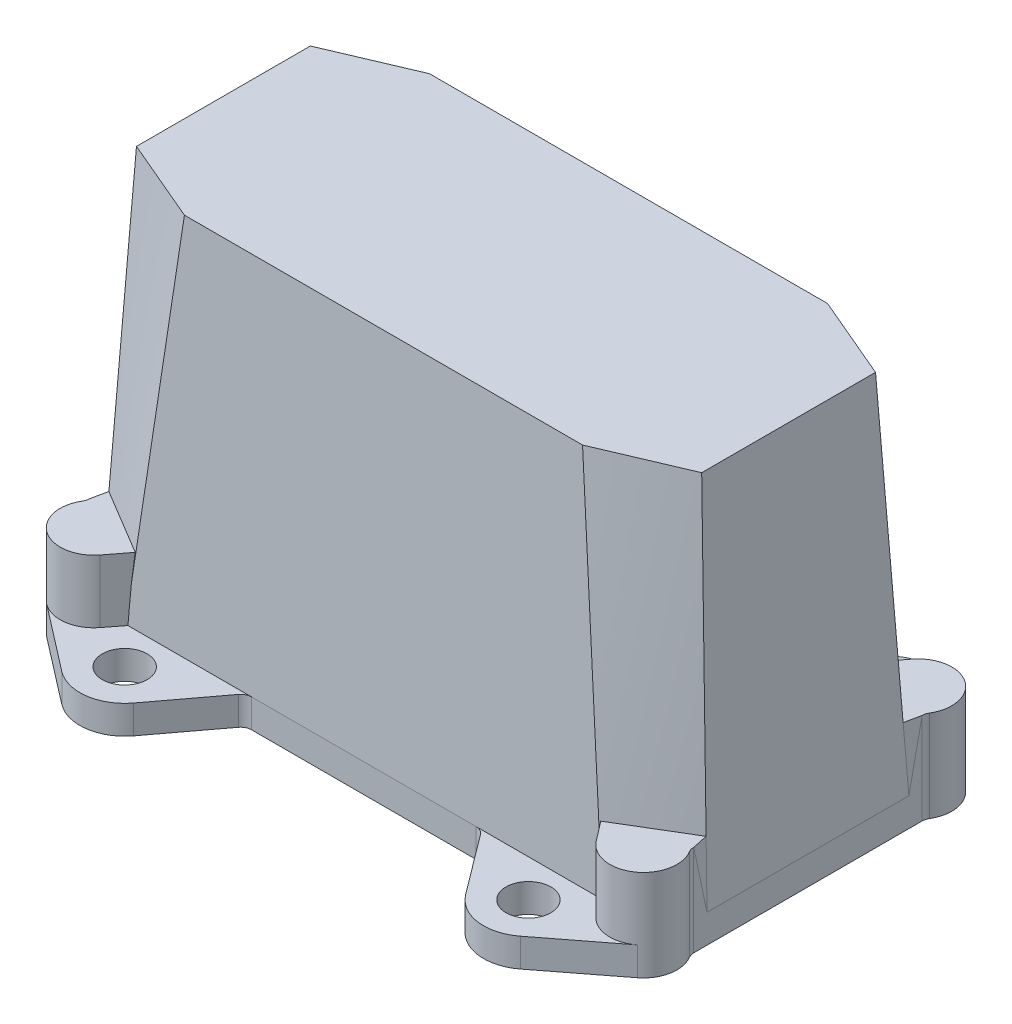
from build123d import *

# Parameters (mm, degrees)
SKETCH3_R           = 2
BOSS_EXTRUDE1_DEPTH = 2.54
FILLET1_R           = 1
BOSS_EXTRUDE2_START = -2.54
BOSS_EXTRUDE2_DEPTH = 8.15
CUT_EXTRUDE1_DEPTH  = 68.045951128
CUT_EXTRUDE2_REACH  = 68.573
CUT_EXTRUDE3_REACH  = 68.573


with BuildPart() as part:
    # Sketch3 → Boss-Extrude1 (new body)
    with BuildSketch(Plane(origin=(0, 0, 0), x_dir=(1, 0, 0), z_dir=(0, 1, 0))):
        with BuildLine():
            Line((-10.5, 12.675), (-14.80167643, 18.402233616))
            ThreePointArc((-14.80167643, 18.402233616), (-17.462309014, 19.963696306), (-20.442771336, 19.167470316))
            Line((-20.442771336, 19.167470316), (-26.332078502, 14.625602737))
            ThreePointArc((-26.332078502, 14.625602737), (-27.469723987, 12.675134617), (-26.925, 10.483824754))
            Line((-26.925, 10.483824754), (-26.925, -10.483824754))
            ThreePointArc((-26.925, -10.483824754), (-27.469723987, -12.675134617), (-26.332078502, -14.625602737))
            Line((-26.332078502, -14.625602737), (-20.442771336, -19.167470316))
            ThreePointArc((-20.442771336, -19.167470316), (-17.462309014, -19.963696306), (-14.80167643, -18.402233616))
            Line((-14.80167643, -18.402233616), (-10.5, -12.675))
            Line((-10.5, -12.675), (10.5, -12.675))
            Line((10.5, -12.675), (14.80167643, -18.402233616))
            ThreePointArc((14.80167643, -18.402233616), (17.462309014, -19.963696306), (20.442771336, -19.167470316))
            Line((20.442771336, -19.167470316), (26.332078502, -14.625602737))
            ThreePointArc((26.332078502, -14.625602737), (27.469723987, -12.675134617), (26.925, -10.483824754))
            Line((26.925, -10.483824754), (26.925, 10.483824754))
            ThreePointArc((26.925, 10.483824754), (27.469723987, 12.675134617), (26.332078502, 14.625602737))
            Line((26.332078502, 14.625602737), (20.442771336, 19.167470316))
            ThreePointArc((20.442771336, 19.167470316), (17.462309014, 19.963696306), (14.80167643, 18.402233616))
            Line((14.80167643, 18.402233616), (10.5, 12.675))
            Line((10.5, 12.675), (-10.5, 12.675))
        make_face()
        with Locations(Location((-18, 16, 0), (0, 0, 270))):
            Circle(SKETCH3_R, mode=Mode.SUBTRACT)
        with Locations(Location((18, 16, 0), (0, 0, 270))):
            Circle(SKETCH3_R, mode=Mode.SUBTRACT)
        with Locations(Location((-18, -16, 0), (0, 0, 270))):
            Circle(SKETCH3_R, mode=Mode.SUBTRACT)
        with Locations(Location((18, -16, 0), (0, 0, 270))):
            Circle(SKETCH3_R, mode=Mode.SUBTRACT)
    extrude(amount=BOSS_EXTRUDE1_DEPTH)

    # Fillet1
    fillet1_edges = [part.edges().sort_by_distance(p)[0] for p in [
        (-26.925, 1.27, 10.483824754),
        (-26.925, 1.27, -10.483824754),
        (-10.5, 1.27, -12.675),
        (10.5, 1.27, -12.675),
        (26.925, 1.27, -10.483824754),
        (26.925, 1.27, 10.483824754),
        (10.5, 1.27, 12.675),
        (-10.5, 1.27, 12.675),
    ]]
    fillet(fillet1_edges, radius=FILLET1_R)

    # Sketch4 → Loft1 section 0
    with BuildSketch(Plane(origin=(0, 2.54, 0), x_dir=(1, 0, 0), z_dir=(0, 1, 0))):
        with BuildLine():
            Line((-26.925, -9), (-21.25, -12.675))
            Line((-21.25, -12.675), (21.25, -12.675))
            Line((21.25, -12.675), (26.925, -9))
            Line((26.925, -9), (26.925, 9))
            Line((26.925, 9), (21.25, 12.675))
            Line((21.25, 12.675), (-21.25, 12.675))
            Line((-21.25, 12.675), (-26.925, 9))
            Line((-26.925, 9), (-26.925, -9))
        make_face()
    # Sketch5 → Loft1 section 1
    with BuildSketch(Plane(origin=(0, 35, 0), x_dir=(1, 0, 0), z_dir=(0, 1, 0))):
        with BuildLine():
            Line((-17.75, -10.925), (17.75, -10.925))
            Line((17.75, -10.925), (25.2, -7.75))
            Line((25.2, -7.75), (25.2, 7.75))
            Line((25.2, 7.75), (17.75, 10.925))
            Line((17.75, 10.925), (-17.75, 10.925))
            Line((-17.75, 10.925), (-25.2, 7.75))
            Line((-25.2, 7.75), (-25.2, -7.75))
            Line((-25.2, -7.75), (-17.75, -10.925))
        make_face()
    loft()

    # Sketch7 → Boss-Extrude2 (add)
    with BuildSketch(Plane(origin=(0, 2.54, 0), x_dir=(1, 0, 0), z_dir=(0, 1, 0)).offset(BOSS_EXTRUDE2_START)):
        with BuildLine():
            Line((-22.124397263, -14.082078502), (-20.292318761, -11.706475765))
            Line((-20.292318761, -11.706475765), (-26.925, -6.591313823))
            Line((-26.925, -6.591313823), (-26.925, -10.183753403))
            ThreePointArc((-26.925, -10.183753403), (-26.961607557, -10.451848535), (-27.06875, -10.700315052))
            ThreePointArc((-27.06875, -10.700315052), (-26.19363735, -14.726205267), (-22.124397263, -14.082078502))
        make_face()
        with BuildLine():
            Line((-26.925, 10.183753403), (-26.925, 6.591313823))
            Line((-26.925, 6.591313823), (-20.292318761, 11.706475765))
            Line((-20.292318761, 11.706475765), (-22.124397263, 14.082078502))
            ThreePointArc((-22.124397263, 14.082078502), (-26.19363735, 14.726205267), (-27.06875, 10.700315052))
            ThreePointArc((-27.06875, 10.700315052), (-26.961607557, 10.451848535), (-26.925, 10.183753403))
        make_face()
        with BuildLine():
            Line((26.925, -10.183753403), (26.925, -6.591313823))
            Line((26.925, -6.591313823), (20.292318761, -11.706475765))
            Line((20.292318761, -11.706475765), (22.124397263, -14.082078502))
            ThreePointArc((22.124397263, -14.082078502), (26.19363735, -14.726205267), (27.06875, -10.700315052))
            ThreePointArc((27.06875, -10.700315052), (26.961607557, -10.451848535), (26.925, -10.183753403))
        make_face()
        with BuildLine():
            Line((22.124397263, 14.082078502), (20.292318761, 11.706475765))
            Line((20.292318761, 11.706475765), (26.925, 6.591313823))
            Line((26.925, 6.591313823), (26.925, 10.183753403))
            ThreePointArc((26.925, 10.183753403), (26.961607557, 10.451848535), (27.06875, 10.700315052))
            ThreePointArc((27.06875, 10.700315052), (26.19363735, 14.726205267), (22.124397263, 14.082078502))
        make_face()
    extrude(amount=BOSS_EXTRUDE2_DEPTH)

    # Sketch8 → Cut-Extrude1 (cut, through all)
    with BuildSketch(Plane(origin=(26.98377644, 1.433980726, 0), x_dir=(0, 0, -1), z_dir=(0.9985909302546928, 0.05306744777231502, 0))):
        Polygon((-9, 1.107579931), (9, 1.107579931), (7.75, 33.613382875), (-7.75, 33.613382875), align=None)
    cut_extrude1 = extrude(amount=CUT_EXTRUDE1_DEPTH, mode=Mode.SUBTRACT)

    # Sketch9 → Cut-Extrude2 (cut, up to next)
    with BuildSketch(Plane(origin=(23.985855334, 1.077940045, -5.108533277), x_dir=(-0.20789815344793566, -0.00934307914900991, -0.9781058555519203), z_dir=(0.9771196273503368, 0.04391239587739548, -0.20810798959926086)), mode=Mode.PRIVATE) as cut_extrude2_sk1:
        Polygon((-15.634592712, 6.932975266), (-14.203471003, 6.946359845), (-14.424341903, 1.328631852), align=None)
    cut_extrude2_tool1 = extrude(cut_extrude2_sk1.sketch, amount=CUT_EXTRUDE2_REACH, mode=Mode.PRIVATE) & part.part
    cut_extrude2 = cut_extrude2_tool1.solids().sort_by_distance((26.825624, 6.28, 9.322573))[0]
    add(cut_extrude2, mode=Mode.SUBTRACT)

    # Sketch10 → Cut-Extrude3 (cut, up to next)
    with BuildSketch(Plane(origin=(23.985855334, 1.077940045, 5.108533278), x_dir=(0.2078981534584427, 0.009343079149391592, -0.9781058555496834), z_dir=(0.9771196273481212, 0.04391239587687057, 0.20810798960977442)), mode=Mode.PRIVATE) as cut_extrude3_sk1:
        Polygon((14.424341903, 1.328631852), (15.634592712, 6.932975266), (14.203471003, 6.946359845), align=None)
    cut_extrude3_tool1 = extrude(cut_extrude3_sk1.sketch, amount=CUT_EXTRUDE3_REACH, mode=Mode.PRIVATE) & part.part
    cut_extrude3 = cut_extrude3_tool1.solids().sort_by_distance((26.825624, 6.28, -9.322573))[0]
    add(cut_extrude3, mode=Mode.SUBTRACT)

    # Mirror1: Cut-Extrude1, Cut-Extrude2, Cut-Extrude3 across plane
    add(cut_extrude1.mirror(Plane(origin=(0, 0, 0), x_dir=(0, 0, 1), z_dir=(1, 0, 0))), mode=Mode.SUBTRACT)
    add(cut_extrude2.mirror(Plane(origin=(0, 0, 0), x_dir=(0, 0, 1), z_dir=(1, 0, 0))), mode=Mode.SUBTRACT)
    add(cut_extrude3.mirror(Plane(origin=(0, 0, 0), x_dir=(0, 0, 1), z_dir=(1, 0, 0))), mode=Mode.SUBTRACT)


solid = part.part
